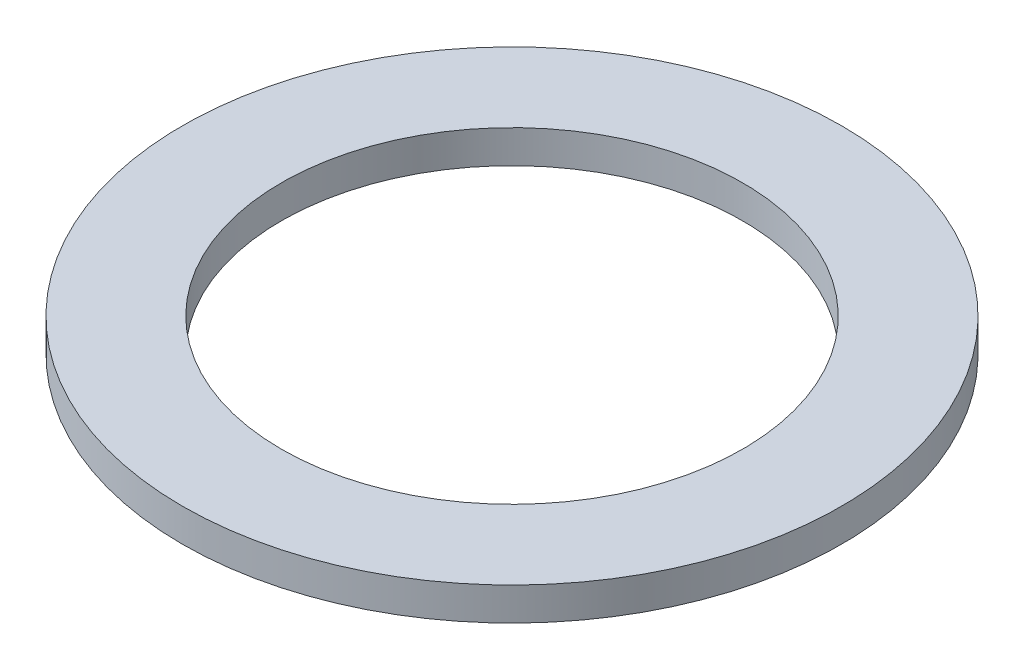
from build123d import *

# Parameters (mm, degrees)
SKETCH1_R           = 6
SKETCH1_R_2         = 4.2
BOSS_EXTRUDE1_DEPTH = 0.6


with BuildPart() as part:
    # Sketch1 → Boss-Extrude1 (new body)
    with BuildSketch(Plane(origin=(0, 0, 0), x_dir=(1, 0, 0), z_dir=(0, 1, 0))):
        with Locations(Location((0, 0, 0), (0, 0, 270))):
            Circle(SKETCH1_R)
        with Locations(Location((0, 0, 0), (0, 0, 270))):
            Circle(SKETCH1_R_2, mode=Mode.SUBTRACT)
    extrude(amount=BOSS_EXTRUDE1_DEPTH)


solid = part.part
